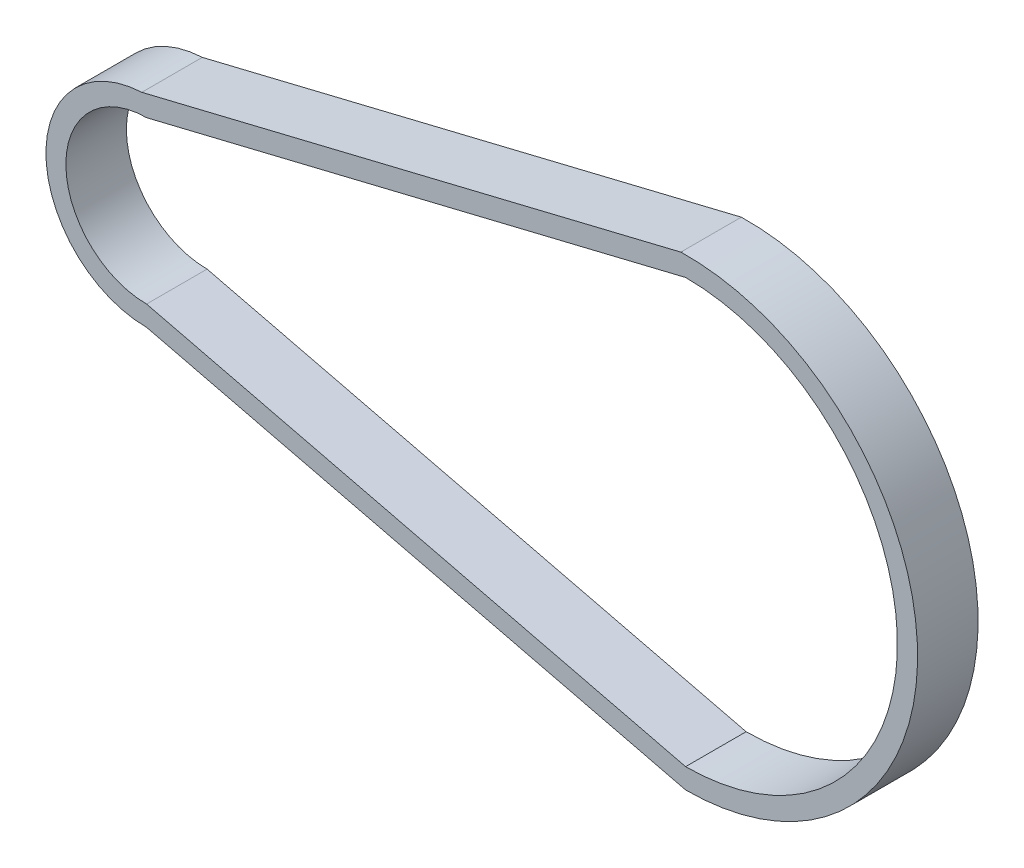
from build123d import *

# Parameters (mm, degrees)
BOSS_EXTRUDE1_DEPTH = 6


with BuildPart() as part:
    # Sketch1 → Boss-Extrude1 (new body)
    with BuildSketch(Plane.XY):
        with BuildLine():
            Line((-0.472727273, 22.94332934), (-53.914284136, 9.94332934))
            ThreePointArc((-53.914284136, 9.94332934), (-63.416022466, -0.259162706), (-53.441556864, -10))
            Line((-53.441556864, -10), (0, -23))
            ThreePointArc((0, -23), (22.998798245, 0.210739523), (-0.472727273, 22.94332934))
        make_face()
        with BuildLine():
            Line((0, 21), (-53.441556864, 8))
            ThreePointArc((-53.441556864, 8), (-61.441556864, 0), (-53.441556864, -8))
            Line((-53.441556864, -8), (0, -21))
            ThreePointArc((0, -21), (21, 0), (0, 21))
        make_face(mode=Mode.SUBTRACT)
    extrude(amount=BOSS_EXTRUDE1_DEPTH)


solid = part.part
